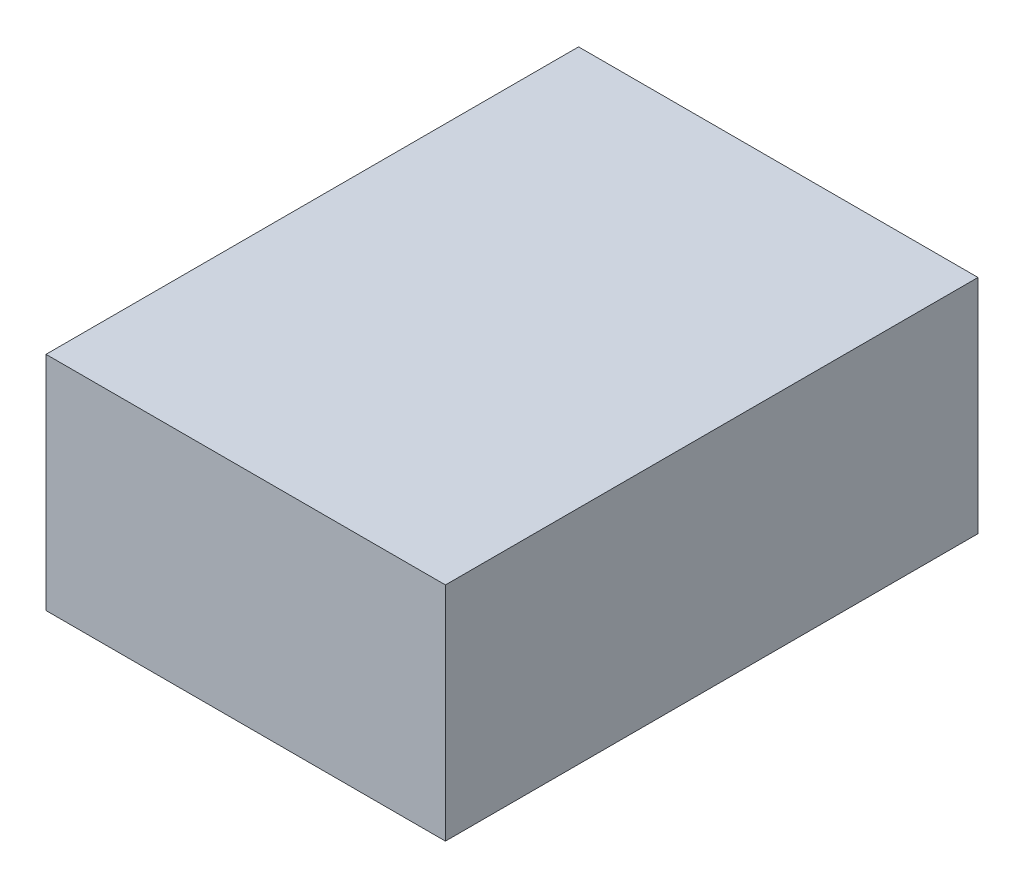
from build123d import *

# Parameters (mm, degrees)
SKETCH_3_W          = 45
SKETCH_3_H          = 25
EXTRUDE_2_DEPTH     = 60
SKETCH_4_W          = 42
SKETCH_4_H          = 22
CUT_EXTRUDE_1_DEPTH = 11


with BuildPart() as part:
    # Эскиз3 → Бобышка-Вытянуть2 (new body)
    with BuildSketch(Plane.XY):
        Rectangle(SKETCH_3_W, SKETCH_3_H)
    extrude(amount=EXTRUDE_2_DEPTH)

    # Эскиз4 → Вырез-Вытянуть1 (cut)
    with BuildSketch(Plane(origin=(0, 0, 0), x_dir=(-1, 0, 0), z_dir=(0, 0, -1))):
        Rectangle(SKETCH_4_W, SKETCH_4_H)
    extrude(amount=-CUT_EXTRUDE_1_DEPTH, mode=Mode.SUBTRACT)


solid = part.part
